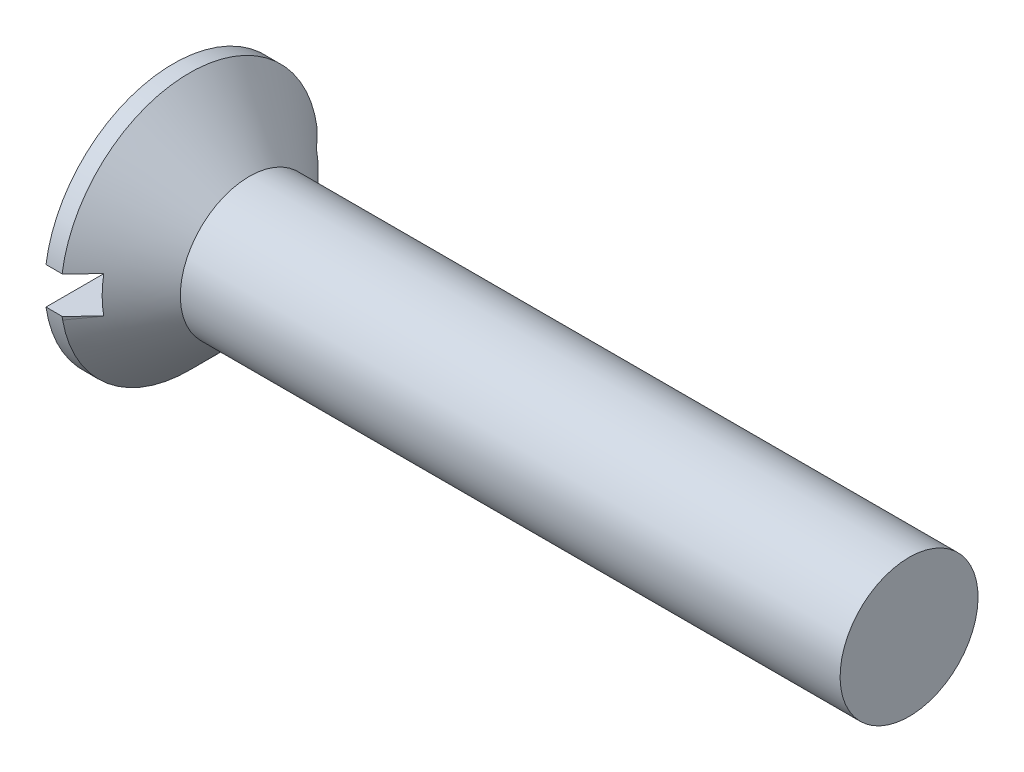
from build123d import *

# Parameters (mm, degrees)
SKETCH2_W          = 5.6
SKETCH2_H          = 0.8
CUT_EXTRUDE1_DEPTH = 0.8


with BuildPart() as part:
    # Sketch1 → Revolve1 (revolve)
    with BuildSketch(Plane.XY):
        Polygon((0, 0), (0, 2.8), (0.35, 2.8), (1.65, 1.5), (16, 1.5), (16, 0), align=None)
    revolve(axis=Axis((16, 0, 0), (-1, 0, 0)))

    # Sketch2 → Cut-Extrude1 (cut)
    with BuildSketch(Plane.ZY):
        Rectangle(SKETCH2_W, SKETCH2_H)
    extrude(amount=-CUT_EXTRUDE1_DEPTH, mode=Mode.SUBTRACT)


solid = part.part
